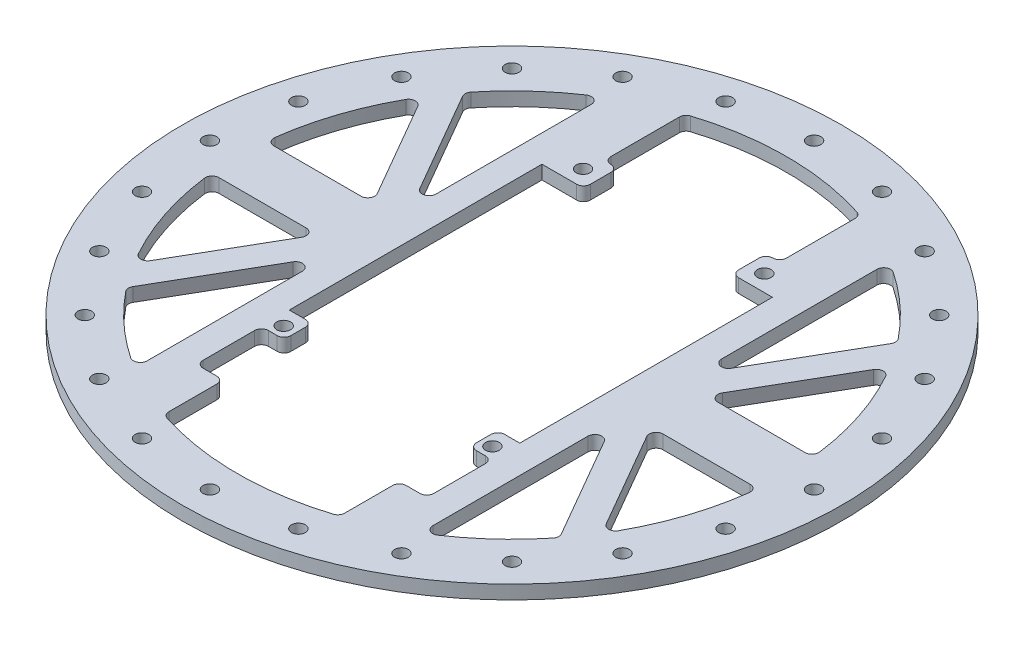
from build123d import *

# Parameters (mm, degrees)
MODEL_R             = 76.199999999
MODEL_R_2           = 1.5875
BOSS_EXTRUDE1_DEPTH = 3.175


with BuildPart() as part:
    # Model → Boss-Extrude1 (new body)
    with BuildSketch(Plane(origin=(0, 0, 0), x_dir=(1, 0, 0), z_dir=(0, 1, 0))):
        with Locations(Location((1e-09, -4e-09, 0), (0, 0, 270))):
            Circle(MODEL_R)
        with Locations(Location((-21.062340001, 37.48772538, 0), (0, 0, 270))):
            Circle(MODEL_R_2, mode=Mode.SUBTRACT)
        with Locations(Location((24.022659999, -28.55227462, 0), (0, 0, 270))):
            Circle(MODEL_R_2, mode=Mode.SUBTRACT)
        with Locations(Location((-34.925, -60.491874454, 0), (0, 0, 270))):
            Circle(MODEL_R_2, mode=Mode.SUBTRACT)
        with Locations(Location((-60.491874454, -34.925, 0), (0, 0, 270))):
            Circle(MODEL_R_2, mode=Mode.SUBTRACT)
        with Locations(Location((-69.85, 0, 0), (0, 0, 270))):
            Circle(MODEL_R_2, mode=Mode.SUBTRACT)
        with Locations(Location((-60.491874454, 34.925, 0), (0, 0, 270))):
            Circle(MODEL_R_2, mode=Mode.SUBTRACT)
        with Locations(Location((0, 69.85, 0), (0, 0, 270))):
            Circle(MODEL_R_2, mode=Mode.SUBTRACT)
        with Locations(Location((34.925, 60.491874454, 0), (0, 0, 270))):
            Circle(MODEL_R_2, mode=Mode.SUBTRACT)
        with Locations(Location((60.491874454, 34.925, 0), (0, 0, 270))):
            Circle(MODEL_R_2, mode=Mode.SUBTRACT)
        with Locations(Location((69.85, 0, 0), (0, 0, 270))):
            Circle(MODEL_R_2, mode=Mode.SUBTRACT)
        with Locations(Location((60.491874454, -34.925, 0), (0, 0, 270))):
            Circle(MODEL_R_2, mode=Mode.SUBTRACT)
        with Locations(Location((34.925, -60.491874454, 0), (0, 0, 270))):
            Circle(MODEL_R_2, mode=Mode.SUBTRACT)
        with Locations(Location((-24.237340001, -28.55227462, 0), (0, 0, 270))):
            Circle(MODEL_R_2, mode=Mode.SUBTRACT)
        with Locations(Location((0, -69.85, 0), (0, 0, 270))):
            Circle(MODEL_R_2, mode=Mode.SUBTRACT)
        with Locations(Location((18.0785103, -67.469918966, 0), (0, 0, 270))):
            Circle(MODEL_R_2, mode=Mode.SUBTRACT)
        with Locations(Location((49.391408667, -49.391408667, 0), (0, 0, 270))):
            Circle(MODEL_R_2, mode=Mode.SUBTRACT)
        with Locations(Location((67.469918966, -18.0785103, 0), (0, 0, 270))):
            Circle(MODEL_R_2, mode=Mode.SUBTRACT)
        with Locations(Location((67.469918966, 18.0785103, 0), (0, 0, 270))):
            Circle(MODEL_R_2, mode=Mode.SUBTRACT)
        with Locations(Location((49.391408667, 49.391408667, 0), (0, 0, 270))):
            Circle(MODEL_R_2, mode=Mode.SUBTRACT)
        with Locations(Location((18.0785103, 67.469918966, 0), (0, 0, 270))):
            Circle(MODEL_R_2, mode=Mode.SUBTRACT)
        with Locations(Location((-18.0785103, 67.469918966, 0), (0, 0, 270))):
            Circle(MODEL_R_2, mode=Mode.SUBTRACT)
        with Locations(Location((-49.391408667, 49.391408667, 0), (0, 0, 270))):
            Circle(MODEL_R_2, mode=Mode.SUBTRACT)
        with Locations(Location((-67.469918966, 18.0785103, 0), (0, 0, 270))):
            Circle(MODEL_R_2, mode=Mode.SUBTRACT)
        with Locations(Location((-67.469918966, -18.0785103, 0), (0, 0, 270))):
            Circle(MODEL_R_2, mode=Mode.SUBTRACT)
        with Locations(Location((-49.391408667, -49.391408667, 0), (0, 0, 270))):
            Circle(MODEL_R_2, mode=Mode.SUBTRACT)
        with Locations(Location((-18.0785103, -67.469918966, 0), (0, 0, 270))):
            Circle(MODEL_R_2, mode=Mode.SUBTRACT)
        with Locations(Location((20.847659999, 37.48772538, 0), (0, 0, 270))):
            Circle(MODEL_R_2, mode=Mode.SUBTRACT)
        with Locations(Location((-34.925, 60.491874454, 0), (0, 0, 270))):
            Circle(MODEL_R_2, mode=Mode.SUBTRACT)
        with BuildLine():
            Line((-39.894076643, -8.73125), (-52.709304986, -30.927876602))
            ThreePointArc((-52.709304986, -30.927876602), (-54.096237861, -31.721580355), (-55.470892632, -30.906796514))
            ThreePointArc((-55.470892632, -30.906796514), (-60.307423447, -19.881264479), (-62.975977178, -8.141025641))
            ThreePointArc((-62.975977178, -8.141025641), (-62.593897589, -6.889392349), (-61.401577748, -6.35))
            Line((-61.401577748, -6.35), (-41.268891971, -6.35))
            ThreePointArc((-41.268891971, -6.35), (-39.894076643, -7.14375), (-39.894076643, -8.73125))
        make_face(mode=Mode.SUBTRACT)
        with BuildLine():
            Line((39.894076642, 8.731249996), (52.709304986, 30.927876598))
            ThreePointArc((52.709304986, 30.927876598), (54.09623786, 31.721580351), (55.470892632, 30.906796511))
            ThreePointArc((55.470892632, 30.906796511), (60.307423447, 19.881264475), (62.975977179, 8.141025637))
            ThreePointArc((62.975977179, 8.141025637), (62.593897589, 6.889392344), (61.401577747, 6.349999996))
            Line((61.401577747, 6.349999996), (41.26889197, 6.349999996))
            ThreePointArc((41.26889197, 6.349999996), (39.894076642, 7.143749997), (39.894076642, 8.731249996))
        make_face(mode=Mode.SUBTRACT)
        with BuildLine():
            Line((-35.982315329, 14.655880652), (-49.529418969, 38.120152452))
            ThreePointArc((-49.529418969, 38.120152452), (-49.737272965, 39.037652431), (-49.389337066, 39.911694823))
            ThreePointArc((-49.389337066, 39.911694823), (-42.917583758, 46.800972253), (-35.494871794, 52.653243734))
            ThreePointArc((-35.494871794, 52.653243734), (-33.862029167, 52.738493705), (-33.020000001, 51.336912639))
            Line((-33.020000001, 51.336912639), (-33.020000001, 15.449630652))
            ThreePointArc((-33.020000001, 15.449630652), (-34.196624767, 13.916223405), (-35.982315329, 14.655880652))
        make_face(mode=Mode.SUBTRACT)
        with BuildLine():
            Line((41.268891969, -6.350000005), (61.401577747, -6.350000005))
            ThreePointArc((61.401577747, -6.350000005), (62.593897589, -6.889392353), (62.975977179, -8.141025645))
            ThreePointArc((62.975977179, -8.141025645), (60.307423447, -19.881264484), (55.470892631, -30.906796519))
            ThreePointArc((55.470892631, -30.906796519), (54.09623786, -31.72158036), (52.709304985, -30.927876606))
            Line((52.709304985, -30.927876606), (39.894076642, -8.731250005))
            ThreePointArc((39.894076642, -8.731250005), (39.894076642, -7.143750005), (41.268891969, -6.350000005))
        make_face(mode=Mode.SUBTRACT)
        with BuildLine():
            Line((17.145000001, 39.997748357), (17.143275501, 35.271178328))
            ThreePointArc((17.143275501, 35.271178328), (17.606151348, 34.14483939), (18.730764569, 33.677786336))
            Line((18.730764569, 33.677786336), (26.5373616, 33.677786336))
            Line((26.5373616, 33.677786336), (26.5373616, -24.742213664))
            Line((26.5373616, -24.742213664), (23.042500002, -24.742213664))
            ThreePointArc((23.042500002, -24.742213664), (21.919967987, -25.207181649), (21.455000002, -26.329713664))
            Line((21.455000002, -26.329713664), (21.455000002, -29.667200004))
            ThreePointArc((21.455000002, -29.667200004), (21.919967987, -30.789732019), (23.042500002, -31.254700004))
            Line((23.042500002, -31.254700004), (25.082500001, -31.254700004))
            ThreePointArc((25.082500001, -31.254700004), (26.205032016, -31.719667989), (26.670000001, -32.842200004))
            Line((26.670000001, -32.842200004), (26.670000001, -44.767500004))
            ThreePointArc((26.670000001, -44.767500004), (26.205032016, -45.890032019), (25.082500001, -46.355000004))
            Line((25.082500001, -46.355000004), (21.907500001, -46.355000004))
            ThreePointArc((21.907500001, -46.355000004), (20.784967986, -46.819967989), (20.320000001, -47.942500004))
            Line((20.320000001, -47.942500004), (20.320000001, -59.010601594))
            ThreePointArc((20.320000001, -59.010601594), (20.013645009, -59.948057576), (19.212820514, -60.523693943))
            ThreePointArc((19.212820514, -60.523693943), (1e-09, -63.500000004), (-19.212820512, -60.523693943))
            ThreePointArc((-19.212820512, -60.523693943), (-20.013645007, -59.948057576), (-20.319999999, -59.010601594))
            Line((-20.319999999, -59.010601594), (-20.319999999, -47.942500004))
            ThreePointArc((-20.319999999, -47.942500004), (-20.784967984, -46.819967989), (-21.907499999, -46.355000004))
            Line((-21.907499999, -46.355000004), (-25.082499999, -46.355000004))
            ThreePointArc((-25.082499999, -46.355000004), (-26.205032014, -45.890032019), (-26.669999999, -44.767500004))
            Line((-26.669999999, -44.767500004), (-26.669999999, -32.842200004))
            ThreePointArc((-26.669999999, -32.842200004), (-26.205032014, -31.719667989), (-25.082499999, -31.254700004))
            Line((-25.082499999, -31.254700004), (-23.0425, -31.254700004))
            ThreePointArc((-23.0425, -31.254700004), (-21.919967985, -30.789732019), (-21.455, -29.667200004))
            Line((-21.455, -29.667200004), (-21.455, -26.329713664))
            ThreePointArc((-21.455, -26.329713664), (-21.919967985, -25.207181649), (-23.0425, -24.742213664))
            Line((-23.0425, -24.742213664), (-26.7518384, -24.742213664))
            Line((-26.7518384, -24.742213664), (-26.7518384, 33.677786336))
            Line((-26.7518384, 33.677786336), (-18.732499999, 33.677786336))
            ThreePointArc((-18.732499999, 33.677786336), (-17.609967984, 34.142754321), (-17.144999999, 35.265286336))
            Line((-17.144999999, 35.265286336), (-17.144999999, 39.997748357))
            ThreePointArc((-17.144999999, 39.997748357), (-17.609967984, 41.120280372), (-18.732499999, 41.585248357))
            ThreePointArc((-18.732499999, 41.585248357), (-19.855032014, 42.050216341), (-20.319999999, 43.172748357))
            Line((-20.319999999, 43.172748357), (-20.319999999, 59.010601586))
            ThreePointArc((-20.319999999, 59.010601586), (-20.013645007, 59.948057567), (-19.212820512, 60.523693934))
            ThreePointArc((-19.212820512, 60.523693934), (1e-09, 63.499999996), (19.212820514, 60.523693934))
            ThreePointArc((19.212820514, 60.523693934), (20.013645009, 59.948057567), (20.320000001, 59.010601586))
            Line((20.320000001, 59.010601586), (20.320000001, 43.172748357))
            ThreePointArc((20.320000001, 43.172748357), (19.855032016, 42.050216342), (18.732500001, 41.585248357))
            ThreePointArc((18.732500001, 41.585248357), (17.609967986, 41.120280372), (17.145000001, 39.997748357))
        make_face(mode=Mode.SUBTRACT)
        with BuildLine():
            Line((33.020000001, 15.449630654), (33.020000001, 51.336912641))
            ThreePointArc((33.020000001, 51.336912641), (33.862029168, 52.738493708), (35.494871796, 52.653243734))
            ThreePointArc((35.494871796, 52.653243734), (42.91758376, 46.800972253), (49.389337068, 39.911694824))
            ThreePointArc((49.389337068, 39.911694824), (49.737272966, 39.037652431), (49.529418969, 38.120152454))
            Line((49.529418969, 38.120152454), (35.982315329, 14.655880654))
            ThreePointArc((35.982315329, 14.655880654), (34.196624767, 13.916223406), (33.020000001, 15.449630654))
        make_face(mode=Mode.SUBTRACT)
        with BuildLine():
            Line((35.982315328, -14.655880662), (49.529418968, -38.120152462))
            ThreePointArc((49.529418968, -38.120152462), (49.737272966, -39.037652439), (49.389337068, -39.911694832))
            ThreePointArc((49.389337068, -39.911694832), (42.91758376, -46.800972262), (35.494871795, -52.653243743))
            ThreePointArc((35.494871795, -52.653243743), (33.862029167, -52.738493716), (33.020000001, -51.336912649))
            Line((33.020000001, -51.336912649), (33.020000001, -15.449630662))
            ThreePointArc((33.020000001, -15.449630662), (34.196624766, -13.916223414), (35.982315328, -14.655880662))
        make_face(mode=Mode.SUBTRACT)
        with BuildLine():
            Line((-49.529418969, -38.120152461), (-35.982315328, -14.65588066))
            ThreePointArc((-35.982315328, -14.65588066), (-34.196624764, -13.91622341), (-33.019999999, -15.449630662))
            Line((-33.019999999, -15.449630662), (-33.019999999, -51.336912649))
            ThreePointArc((-33.019999999, -51.336912649), (-33.862029166, -52.738493716), (-35.494871794, -52.653243743))
            ThreePointArc((-35.494871794, -52.653243743), (-42.917583758, -46.800972262), (-49.389337066, -39.911694832))
            ThreePointArc((-49.389337066, -39.911694832), (-49.737272965, -39.037652439), (-49.529418969, -38.120152461))
        make_face(mode=Mode.SUBTRACT)
        with BuildLine():
            Line((-41.26889197, 6.349999996), (-61.401577748, 6.349999996))
            ThreePointArc((-61.401577748, 6.349999996), (-62.593897588, 6.889392345), (-62.975977177, 8.141025637))
            ThreePointArc((-62.975977177, 8.141025637), (-60.307423445, 19.881264475), (-55.470892629, 30.906796511))
            ThreePointArc((-55.470892629, 30.906796511), (-54.096237858, 31.721580351), (-52.709304983, 30.927876598))
            Line((-52.709304983, 30.927876598), (-39.89407664, 8.731249996))
            ThreePointArc((-39.89407664, 8.731249996), (-39.89407664, 7.143749995), (-41.26889197, 6.349999996))
        make_face(mode=Mode.SUBTRACT)
    extrude(amount=BOSS_EXTRUDE1_DEPTH)


solid = part.part
